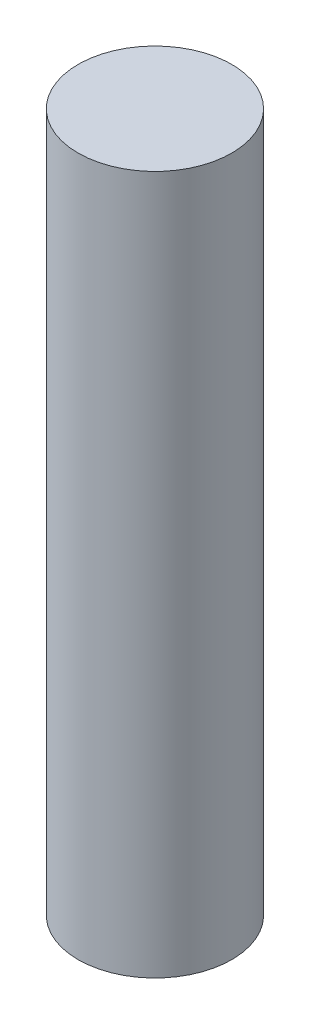
from build123d import *

# Parameters (mm, degrees)
SKETCH1_R           = 27.5
BOSS_EXTRUDE1_DEPTH = 250


with BuildPart() as part:
    # Sketch1 → Boss-Extrude1 (new body)
    with BuildSketch(Plane(origin=(0, 0, 0), x_dir=(1, 0, 0), z_dir=(0, 1, 0))):
        with Locations(Location((0, 0, 0), (0, 0, 270))):
            Circle(SKETCH1_R)
    extrude(amount=BOSS_EXTRUDE1_DEPTH)


solid = part.part
